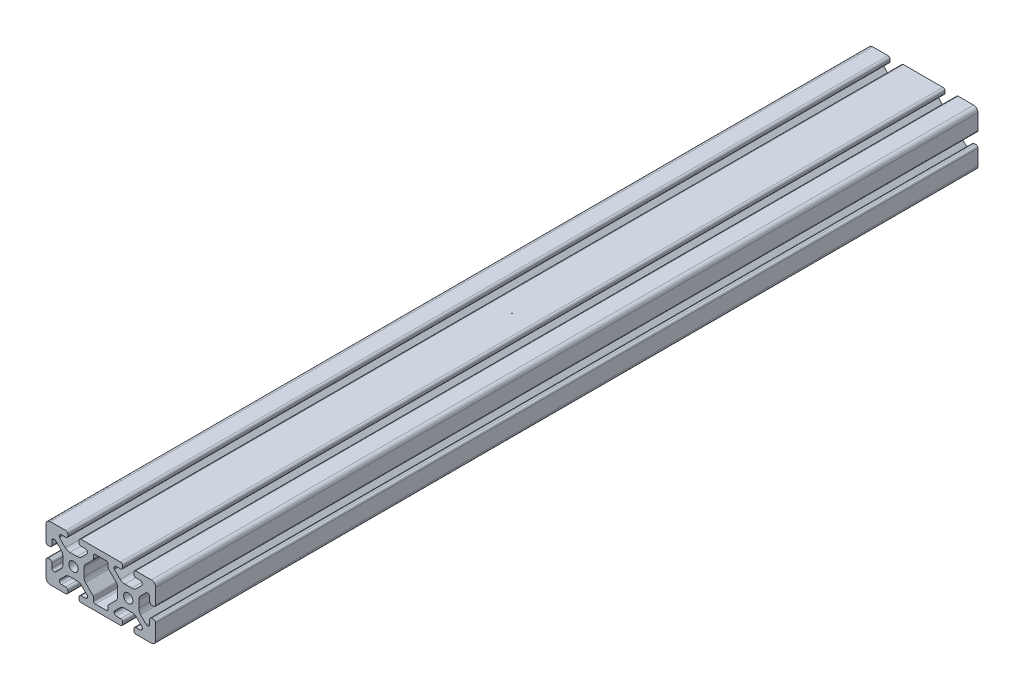
from build123d import *

# Parameters (mm, degrees)
SKETCH1_R          = 3.4
EXTRUDE1_DEPTH     = 600
SKETCH2_R          = 0.25
SKINNY_SIDE_DEPTH  = 1
SKETCH3_R          = 0.25
CUT_EXTRUDE3_DEPTH = 606.640452706


with BuildPart() as part:
    # Sketch1 → Extrude1 (new body)
    with BuildSketch(Plane.XY):
        with BuildLine():
            Line((-14.371895096, 20), (14.371895096, 20))
            ThreePointArc((14.371895096, 20), (15.50899084, 19.51254943), (15.94, 18.352883145))
            Line((15.94, 18.352883145), (15.94, 17.172883145))
            ThreePointArc((15.94, 17.172883145), (15.453758432, 16.112250378), (14.37, 15.68))
            Line((14.37, 15.68), (11.285, 15.68))
            ThreePointArc((11.285, 15.68), (10.174842354, 15.220157646), (9.715, 14.11))
            Line((9.715, 14.11), (9.715, 13.654503602))
            ThreePointArc((9.715, 13.654503602), (9.772851555, 13.363664194), (9.937598846, 13.117102448))
            Line((9.937598846, 13.117102448), (14.091872782, 8.962828513))
            ThreePointArc((14.091872782, 8.962828513), (15.647416634, 8.002049766), (17.450629992, 7.7))
            Line((17.450629992, 7.7), (22.549370008, 7.7))
            ThreePointArc((22.549370008, 7.7), (24.352583366, 8.002049766), (25.908127218, 8.962828513))
            Line((25.908127218, 8.962828513), (30.062401154, 13.117102448))
            ThreePointArc((30.062401154, 13.117102448), (30.227148445, 13.363664194), (30.285, 13.654503602))
            Line((30.285, 13.654503602), (30.285, 14.11))
            ThreePointArc((30.285, 14.11), (29.825157646, 15.220157646), (28.715, 15.68))
            Line((28.715, 15.68), (25.63, 15.68))
            ThreePointArc((25.63, 15.68), (24.519842354, 16.139842354), (24.06, 17.25))
            Line((24.06, 17.25), (24.06, 18.431164164))
            ThreePointArc((24.06, 18.431164164), (24.498672143, 19.519739968), (25.569550674, 20))
            Line((25.569550674, 20), (33, 20))
            Line((33, 20), (36.83, 20))
            ThreePointArc((36.83, 20), (39.067780363, 19.075288119), (40, 16.840624931))
            Line((40, 16.840624931), (40, 13.010624931))
            Line((40, 13.010624931), (40, 5.582508737))
            ThreePointArc((40, 5.582508737), (39.486387554, 4.464397964), (38.324306777, 4.06))
            Line((38.324306777, 4.06), (37.144306789, 4.06))
            ThreePointArc((37.144306789, 4.06), (36.103082753, 4.554299861), (35.68, 5.626438298))
            Line((35.68, 5.626438298), (35.68, 8.711438298))
            ThreePointArc((35.68, 8.711438298), (35.220157646, 9.821595945), (34.11, 10.281438298))
            Line((34.11, 10.281438298), (33.650941901, 10.281438298))
            ThreePointArc((33.650941901, 10.281438298), (33.360102492, 10.223586743), (33.113540747, 10.058839452))
            Line((33.113540747, 10.058839452), (29.01112516, 5.956423865))
            ThreePointArc((29.01112516, 5.956423865), (28.027864944, 4.392105869), (27.715866667, 2.570966522))
            Line((27.715866667, 2.570966522), (27.715866667, -2.502014759))
            ThreePointArc((27.715866667, -2.502014759), (27.988460835, -4.298258683), (28.915473265, -5.86077197))
            Line((28.915473265, -5.86077197), (33.171894658, -10.117193363))
            ThreePointArc((33.171894658, -10.117193363), (33.418456403, -10.281940654), (33.709295811, -10.339792209))
            Line((33.709295811, -10.339792209), (34.110956402, -10.339792209))
            ThreePointArc((34.110956402, -10.339792209), (35.240319888, -9.860405851), (35.68, -8.714999999))
            Line((35.68, -8.714999999), (35.68, -5.629999999))
            ThreePointArc((35.68, -5.629999999), (36.13984232, -4.519842386), (37.249999905, -4.06))
            Line((37.249999905, -4.06), (38.43, -4.06))
            ThreePointArc((38.43, -4.06), (39.519320595, -4.498268351), (40, -5.569550674))
            Line((40, -5.569550674), (40, -13))
            Line((40, -13), (40, -16.83))
            ThreePointArc((40, -16.83), (39.153330856, -18.99480488), (37.057427332, -20))
            Line((37.057427332, -20), (33.227427332, -20))
            Line((33.227427332, -20), (25.796978006, -20))
            ThreePointArc((25.796978006, -20), (24.580537154, -19.606606664), (24.06, -18.438904761))
            Line((24.06, -18.438904761), (24.06, -17.25))
            ThreePointArc((24.06, -17.25), (24.519842354, -16.139842354), (25.63, -15.68))
            Line((25.63, -15.68), (28.715, -15.68))
            ThreePointArc((28.715, -15.68), (29.825157646, -15.220157646), (30.285, -14.11))
            Line((30.285, -14.11), (30.285, -13.654503602))
            ThreePointArc((30.285, -13.654503602), (30.227148445, -13.363664194), (30.062401154, -13.117102448))
            Line((30.062401154, -13.117102448), (26.309520343, -9.364221638))
            ThreePointArc((26.309520343, -9.364221638), (24.979669869, -8.257223741), (23.341546451, -7.7))
            Line((23.341546451, -7.7), (16.658453549, -7.7))
            ThreePointArc((16.658453549, -7.7), (15.020330131, -8.257223741), (13.690479657, -9.364221638))
            Line((13.690479657, -9.364221638), (9.937598846, -13.117102448))
            ThreePointArc((9.937598846, -13.117102448), (9.772851555, -13.363664194), (9.715, -13.654503602))
            Line((9.715, -13.654503602), (9.715, -14.11))
            ThreePointArc((9.715, -14.11), (10.174842354, -15.220157646), (11.285, -15.68))
            Line((11.285, -15.68), (14.37, -15.68))
            ThreePointArc((14.37, -15.68), (15.480157646, -16.139842354), (15.94, -17.25))
            Line((15.94, -17.25), (15.94, -18.43))
            ThreePointArc((15.94, -18.43), (15.480157646, -19.540157646), (14.37, -20))
            Line((14.37, -20), (5.99100603, -20))
            Line((5.99100603, -20), (-1.780052417, -20))
            Line((-1.780052417, -20), (-5.99100603, -20))
            Line((-5.99100603, -20), (-14.37, -20))
            ThreePointArc((-14.37, -20), (-15.480157646, -19.540157646), (-15.94, -18.43))
            Line((-15.94, -18.43), (-15.94, -17.25))
            ThreePointArc((-15.94, -17.25), (-15.480157646, -16.139842354), (-14.37, -15.68))
            Line((-14.37, -15.68), (-11.285, -15.68))
            ThreePointArc((-11.285, -15.68), (-10.174842354, -15.220157646), (-9.715, -14.11))
            Line((-9.715, -14.11), (-9.715, -13.654503602))
            ThreePointArc((-9.715, -13.654503602), (-9.772851555, -13.363664194), (-9.937598846, -13.117102448))
            Line((-9.937598846, -13.117102448), (-13.690479657, -9.364221638))
            ThreePointArc((-13.690479657, -9.364221638), (-15.020330131, -8.257223741), (-16.658453549, -7.7))
            Line((-16.658453549, -7.7), (-23.341546451, -7.7))
            ThreePointArc((-23.341546451, -7.7), (-24.979669869, -8.257223741), (-26.309520343, -9.364221638))
            Line((-26.309520343, -9.364221638), (-30.062401154, -13.117102448))
            ThreePointArc((-30.062401154, -13.117102448), (-30.227148445, -13.363664194), (-30.285, -13.654503602))
            Line((-30.285, -13.654503602), (-30.285, -14.11))
            ThreePointArc((-30.285, -14.11), (-29.825157646, -15.220157646), (-28.715, -15.68))
            Line((-28.715, -15.68), (-25.63, -15.68))
            ThreePointArc((-25.63, -15.68), (-24.519842354, -16.139842354), (-24.06, -17.25))
            Line((-24.06, -17.25), (-24.06, -18.438904761))
            ThreePointArc((-24.06, -18.438904761), (-24.580537154, -19.606606664), (-25.796978006, -20))
            Line((-25.796978006, -20), (-33.227427332, -20))
            Line((-33.227427332, -20), (-37.057427332, -20))
            ThreePointArc((-37.057427332, -20), (-39.153330856, -18.99480488), (-40, -16.83))
            Line((-40, -16.83), (-40, -13))
            Line((-40, -13), (-40, -5.569550674))
            ThreePointArc((-40, -5.569550674), (-39.519320595, -4.498268351), (-38.43, -4.06))
            Line((-38.43, -4.06), (-37.249999905, -4.06))
            ThreePointArc((-37.249999905, -4.06), (-36.13984232, -4.519842386), (-35.68, -5.629999999))
            Line((-35.68, -5.629999999), (-35.68, -8.714999999))
            ThreePointArc((-35.68, -8.714999999), (-35.240319888, -9.860405851), (-34.110956402, -10.339792209))
            Line((-34.110956402, -10.339792209), (-33.709295811, -10.339792209))
            ThreePointArc((-33.709295811, -10.339792209), (-33.418456403, -10.281940654), (-33.171894658, -10.117193363))
            Line((-33.171894658, -10.117193363), (-28.915473265, -5.86077197))
            ThreePointArc((-28.915473265, -5.86077197), (-27.988460835, -4.298258683), (-27.715866667, -2.502014759))
            Line((-27.715866667, -2.502014759), (-27.715866667, 2.570966522))
            ThreePointArc((-27.715866667, 2.570966522), (-28.027864944, 4.392105869), (-29.01112516, 5.956423865))
            Line((-29.01112516, 5.956423865), (-33.113540747, 10.058839452))
            ThreePointArc((-33.113540747, 10.058839452), (-33.360102492, 10.223586743), (-33.650941901, 10.281438298))
            Line((-33.650941901, 10.281438298), (-34.11, 10.281438298))
            ThreePointArc((-34.11, 10.281438298), (-35.220157646, 9.821595945), (-35.68, 8.711438298))
            Line((-35.68, 8.711438298), (-35.68, 5.626438298))
            ThreePointArc((-35.68, 5.626438298), (-36.103082753, 4.554299861), (-37.144306789, 4.06))
            Line((-37.144306789, 4.06), (-38.324306777, 4.06))
            ThreePointArc((-38.324306777, 4.06), (-39.486387554, 4.464397964), (-40, 5.582508737))
            Line((-40, 5.582508737), (-40, 13.010624931))
            Line((-40, 13.010624931), (-40, 16.840624931))
            ThreePointArc((-40, 16.840624931), (-39.067780363, 19.075288119), (-36.83, 20))
            Line((-36.83, 20), (-33, 20))
            Line((-33, 20), (-25.569550674, 20))
            ThreePointArc((-25.569550674, 20), (-24.498672143, 19.519739968), (-24.06, 18.431164164))
            Line((-24.06, 18.431164164), (-24.06, 17.25))
            ThreePointArc((-24.06, 17.25), (-24.519842354, 16.139842354), (-25.63, 15.68))
            Line((-25.63, 15.68), (-28.715, 15.68))
            ThreePointArc((-28.715, 15.68), (-29.825157646, 15.220157646), (-30.285, 14.11))
            Line((-30.285, 14.11), (-30.285, 13.654503602))
            ThreePointArc((-30.285, 13.654503602), (-30.227148445, 13.363664194), (-30.062401154, 13.117102448))
            Line((-30.062401154, 13.117102448), (-25.908127218, 8.962828513))
            ThreePointArc((-25.908127218, 8.962828513), (-24.352583366, 8.002049766), (-22.549370008, 7.7))
            Line((-22.549370008, 7.7), (-17.450629992, 7.7))
            ThreePointArc((-17.450629992, 7.7), (-15.647416634, 8.002049766), (-14.091872782, 8.962828513))
            Line((-14.091872782, 8.962828513), (-9.937598846, 13.117102448))
            ThreePointArc((-9.937598846, 13.117102448), (-9.772851555, 13.363664194), (-9.715, 13.654503602))
            Line((-9.715, 13.654503602), (-9.715, 14.11))
            ThreePointArc((-9.715, 14.11), (-10.174842354, 15.220157646), (-11.285, 15.68))
            Line((-11.285, 15.68), (-14.37, 15.68))
            ThreePointArc((-14.37, 15.68), (-15.453758432, 16.112250378), (-15.94, 17.172883145))
            Line((-15.94, 17.172883145), (-15.94, 18.352883145))
            ThreePointArc((-15.94, 18.352883145), (-15.50899084, 19.51254943), (-14.371895096, 20))
        make_face()
        with Locations((-20, 0)):
            Circle(SKETCH1_R, mode=Mode.SUBTRACT)
        with Locations(Location((20, 0, 0), (0, 0, 180))):
            Circle(SKETCH1_R, mode=Mode.SUBTRACT)
        with BuildLine():
            Line((4.071751167, 15.68), (-4.071751167, 15.68))
            ThreePointArc((-4.071751167, 15.68), (-4.969776779, 15.308025612), (-5.341751167, 14.41))
            Line((-5.341751167, 14.41), (-5.341751167, 12.129598762))
            ThreePointArc((-5.341751167, 12.129598762), (-5.438424161, 11.643590803), (-5.713725555, 11.23157315))
            Line((-5.713725555, 11.23157315), (-10.598777023, 6.346521682))
            ThreePointArc((-10.598777023, 6.346521682), (-11.737774423, 4.964558417), (-12.284133333, 3.259087959))
            Line((-12.284133333, 3.259087959), (-12.284133333, -2.724972544))
            ThreePointArc((-12.284133333, -2.724972544), (-12.005210609, -4.328708179), (-11.201199443, -5.744099262))
            Line((-11.201199443, -5.744099262), (-5.713725555, -11.23157315))
            ThreePointArc((-5.713725555, -11.23157315), (-5.438424161, -11.643590803), (-5.341751167, -12.129598762))
            Line((-5.341751167, -12.129598762), (-5.341751167, -14.41))
            ThreePointArc((-5.341751167, -14.41), (-4.969776779, -15.308025612), (-4.071751167, -15.68))
            Line((-4.071751167, -15.68), (4.071751167, -15.68))
            ThreePointArc((4.071751167, -15.68), (4.969776779, -15.308025612), (5.341751167, -14.41))
            Line((5.341751167, -14.41), (5.341751167, -12.129598762))
            ThreePointArc((5.341751167, -12.129598762), (5.438424161, -11.643590803), (5.713725555, -11.23157315))
            Line((5.713725555, -11.23157315), (11.201199443, -5.744099262))
            ThreePointArc((11.201199443, -5.744099262), (12.005210609, -4.328708179), (12.284133333, -2.724972544))
            Line((12.284133333, -2.724972544), (12.284133333, 3.259087959))
            ThreePointArc((12.284133333, 3.259087959), (11.737774423, 4.964558417), (10.598777023, 6.346521682))
            Line((10.598777023, 6.346521682), (5.713725555, 11.23157315))
            ThreePointArc((5.713725555, 11.23157315), (5.438424161, 11.643590803), (5.341751167, 12.129598762))
            Line((5.341751167, 12.129598762), (5.341751167, 14.41))
            ThreePointArc((5.341751167, 14.41), (4.969776779, 15.308025612), (4.071751167, 15.68))
        make_face(mode=Mode.SUBTRACT)
    extrude(amount=-EXTRUDE1_DEPTH)

    # Sketch2 → Skinny Side (cut)
    with BuildSketch(Plane(origin=(0, 20, 0), x_dir=(1, 0, 0), z_dir=(0, 1, 0))):
        with Locations(Location((0, 300, 0), (0, 0, 180))):
            Circle(SKETCH2_R)
    extrude(amount=-SKINNY_SIDE_DEPTH, mode=Mode.SUBTRACT)

    # Sketch3 → Cut-Extrude3 (cut, through all)
    with BuildSketch(Plane.ZY.offset(40)):
        with Locations((-300, 0.017237941)):
            Circle(SKETCH3_R)
    extrude(amount=-CUT_EXTRUDE3_DEPTH, mode=Mode.SUBTRACT)


solid = part.part
